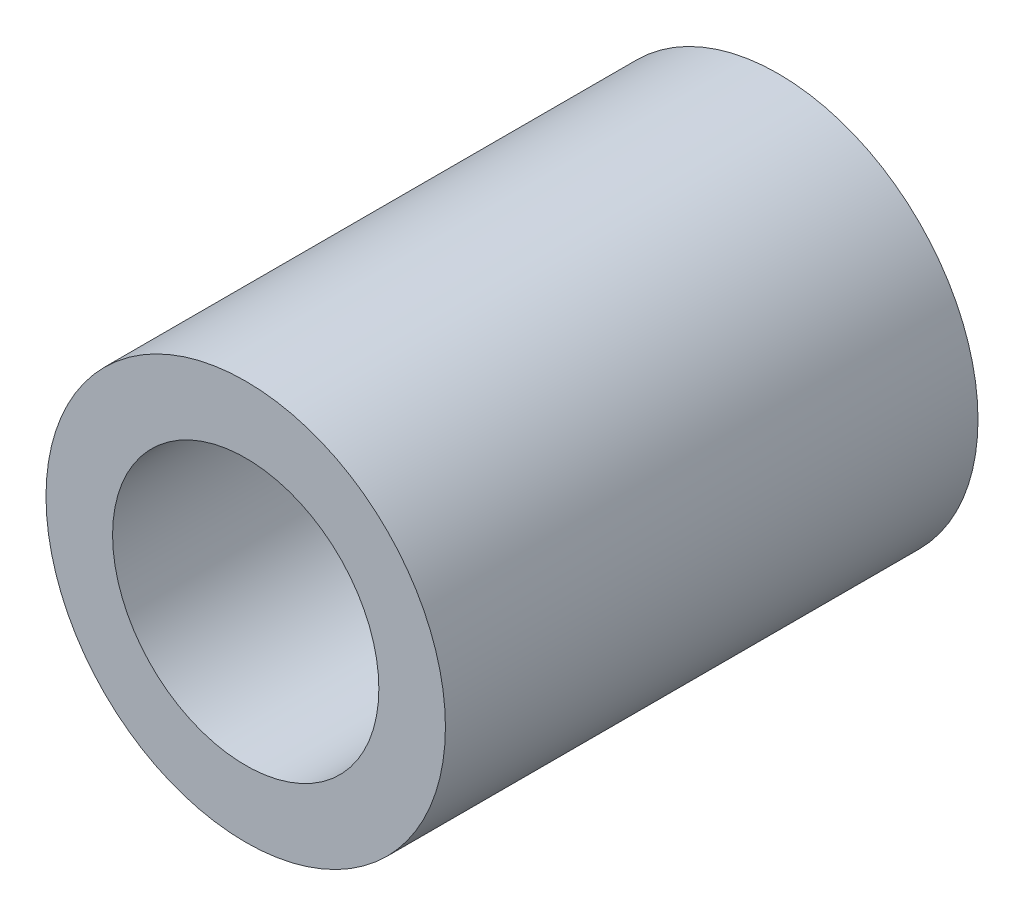
from build123d import *

# Parameters (mm, degrees)
SKETCH_1_R          = 3
EXTRUDE_1_DEPTH     = 8
SKETCH_2_R          = 2
CUT_EXTRUDE_1_DEPTH = 10.055385138


with BuildPart() as part:
    # ｽｹｯﾁ1 → ﾎﾞｽ - 押し出し1 (new body)
    with BuildSketch(Plane.XY):
        Circle(SKETCH_1_R)
    extrude(amount=EXTRUDE_1_DEPTH)

    # ｽｹｯﾁ2 → ｶｯﾄ - 押し出し1 (cut, through all)
    with BuildSketch(Plane.XY.offset(8)):
        Circle(SKETCH_2_R)
    extrude(amount=-CUT_EXTRUDE_1_DEPTH, mode=Mode.SUBTRACT)


solid = part.part
